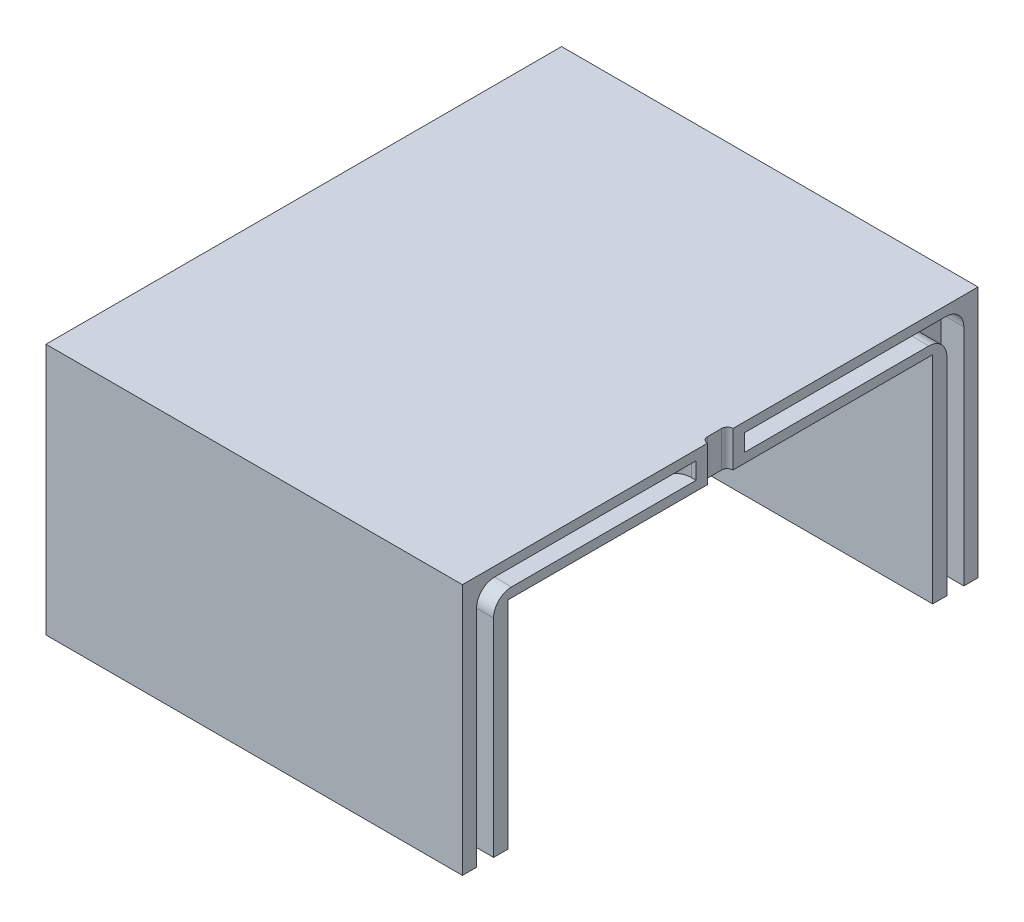
from build123d import *

# Parameters (mm, degrees)
WALL_DEPTH                = 19.05
ROOF_START                = 19.05
ROOF_DEPTH                = 3.175
F_2_56_TAPPED_HOLE1_D     = 1.778
F_2_56_TAPPED_HOLE1_DEPTH = 5.73
F_2_56_TAPPED_HOLE1_TIP   = 0.53416509
F_2MM_DEPTH_CUT_DEPTH     = 2
F_1_16_IN_FILLET_R        = 1.5875


with BuildPart() as part:
    # MainSketch → Wall (new body)
    with BuildSketch(Plane(origin=(0, 0, 0), x_dir=(1, 0, 0), z_dir=(0, 1, 0))):
        Polygon((-32.75, -4), (0, -4), (0, 0), (-36.75, 0), (-36.75, -45.5), (0, -45.5), (0, -41.5), (-32.75, -41.5), align=None)
    extrude(amount=WALL_DEPTH)

    # MainSketch<3> → Roof (add)
    with BuildSketch(Plane(origin=(0, 0, 0), x_dir=(1, 0, 0), z_dir=(0, 1, 0)).offset(ROOF_START)):
        with BuildLine():
            Line((0, -21.625), (0, 0))
            Line((0, 0), (-36.75, 0))
            Line((-36.75, 0), (-36.75, -45.5))
            Line((-36.75, -45.5), (0, -45.5))
            Line((0, -45.5), (0, -23.875))
            ThreePointArc((0, -23.875), (-0.353553391, -23.728553391), (-0.5, -23.375))
            Line((-0.5, -23.375), (-0.5, -22.125))
            ThreePointArc((-0.5, -22.125), (-0.353553391, -21.771446609), (0, -21.625))
        make_face()
    extrude(amount=ROOF_DEPTH)

    # #2-56 Tapped Hole1
    with Locations(Plane(origin=(-18.375, 0, 2.5), x_dir=(0, 0, -1), z_dir=(0, -1, 0))):
        with Locations((0, 0), (-40.5, 0)):
            Hole(F_2_56_TAPPED_HOLE1_D / 2, depth=F_2_56_TAPPED_HOLE1_DEPTH)
            with Locations((0, 0, -(F_2_56_TAPPED_HOLE1_DEPTH + F_2_56_TAPPED_HOLE1_TIP / 2))):  # 118° drill point
                Cone(0, F_2_56_TAPPED_HOLE1_D / 2, F_2_56_TAPPED_HOLE1_TIP, mode=Mode.SUBTRACT)

    # Sketch3 → 2mm depth cut (cut)
    with BuildSketch(Plane(origin=(0, 0, 0), x_dir=(0, 0, -1), z_dir=(1, 0, 0))):
        Polygon((-44.25, 21.3875), (-44.25, 0), (-42.75, 0), (-42.75, 19.8875), (-24.875, 19.8875), (-24.875, 21.3875), align=None)
        Polygon((-1.25, 21.3875), (-20.625, 21.3875), (-20.625, 19.8875), (-2.75, 19.8875), (-2.75, 0), (-1.25, 0), align=None)
    extrude(amount=-F_2MM_DEPTH_CUT_DEPTH, mode=Mode.SUBTRACT)

    # 1/16 in fillet
    f_1_16_in_fillet_edges = [part.edges().sort_by_distance(p)[0] for p in [
        (-1, 19.8875, 42.75),
        (-1, 21.3875, 44.25),
        (-2, 20.6375, 24.875),
        (-1, 21.3875, 1.25),
        (-1, 19.8875, 2.75),
        (-2, 20.6375, 20.625),
    ]]
    fillet(f_1_16_in_fillet_edges, radius=F_1_16_IN_FILLET_R)


solid = part.part
